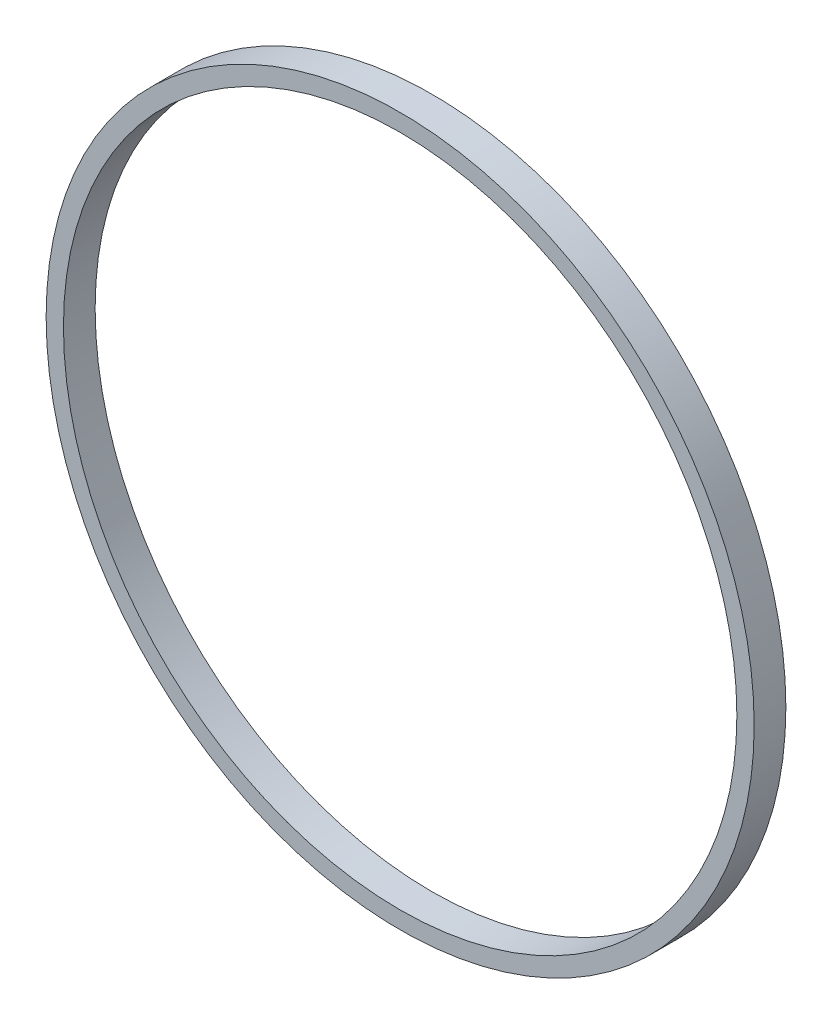
from build123d import *

# Parameters (mm, degrees)
SKETCH1_R           = 49.0855
SKETCH1_R_2         = 46.6852
BOSS_EXTRUDE1_DEPTH = 4.3942


with BuildPart() as part:
    # Sketch1 → Boss-Extrude1 (new body)
    with BuildSketch(Plane.XY):
        Circle(SKETCH1_R)
        Circle(SKETCH1_R_2, mode=Mode.SUBTRACT)
    extrude(amount=BOSS_EXTRUDE1_DEPTH)


solid = part.part
